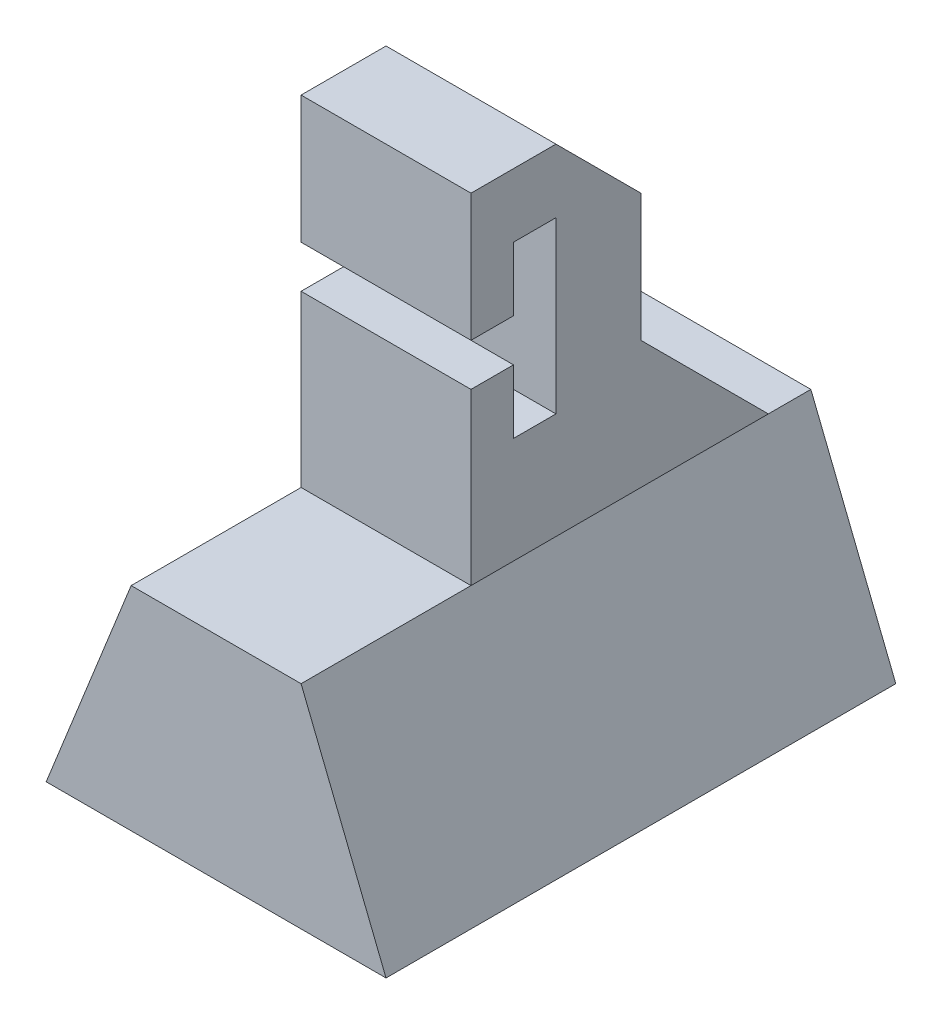
from build123d import *

# Parameters (mm, degrees)
BOSS_EXTRUDE1_DEPTH = 12
SKETCH2_W           = 4
SKETCH2_H           = 4
BOSS_EXTRUDE2_DEPTH = 8
CHAMFER1_SIZE       = 3
CUT_EXTRUDE1_DEPTH  = 18
CHAMFER2_SIZE       = 2


with BuildPart() as part:
    # Sketch1 → Boss-Extrude1 (new body)
    with BuildSketch(Plane.XY):
        Polygon((-3.130434783, -2.608695652), (4.869565217, -2.608695652), (2.869565217, 2.391304348), (-1.130434783, 2.391304348), align=None)
    extrude(amount=BOSS_EXTRUDE1_DEPTH)

    # Sketch2 → Boss-Extrude2 (add)
    with BuildSketch(Plane(origin=(0, 2.391304348, 0), x_dir=(1, 0, 0), z_dir=(0, 1, 0))):
        with Locations((0.869565217, -6)):
            Rectangle(SKETCH2_W, SKETCH2_H)
    extrude(amount=BOSS_EXTRUDE2_DEPTH)

    # Chamfer1
    chamfer1_edges = [part.edges().sort_by_distance(p)[0] for p in [
        (0.869565217, 2.391304348, 4),
    ]]
    chamfer(chamfer1_edges, length=CHAMFER1_SIZE)

    # Sketch3 → Cut-Extrude1 (cut)
    with BuildSketch(Plane(origin=(2.869565217, 0, 0), x_dir=(0, 0, -1), z_dir=(1, 0, 0))):
        Polygon((-7, 8.891304348), (-6, 8.891304348), (-6, 4.891304348), (-7, 4.891304348), (-7, 6.391304348), (-8, 6.391304348), (-8, 7.391304348), (-7, 7.391304348), align=None)
    extrude(amount=-CUT_EXTRUDE1_DEPTH, mode=Mode.SUBTRACT)

    # Chamfer2
    chamfer2_edges = [part.edges().sort_by_distance(p)[0] for p in [
        (0.869565217, 10.391304348, 4),
    ]]
    chamfer(chamfer2_edges, length=CHAMFER2_SIZE)


solid = part.part
